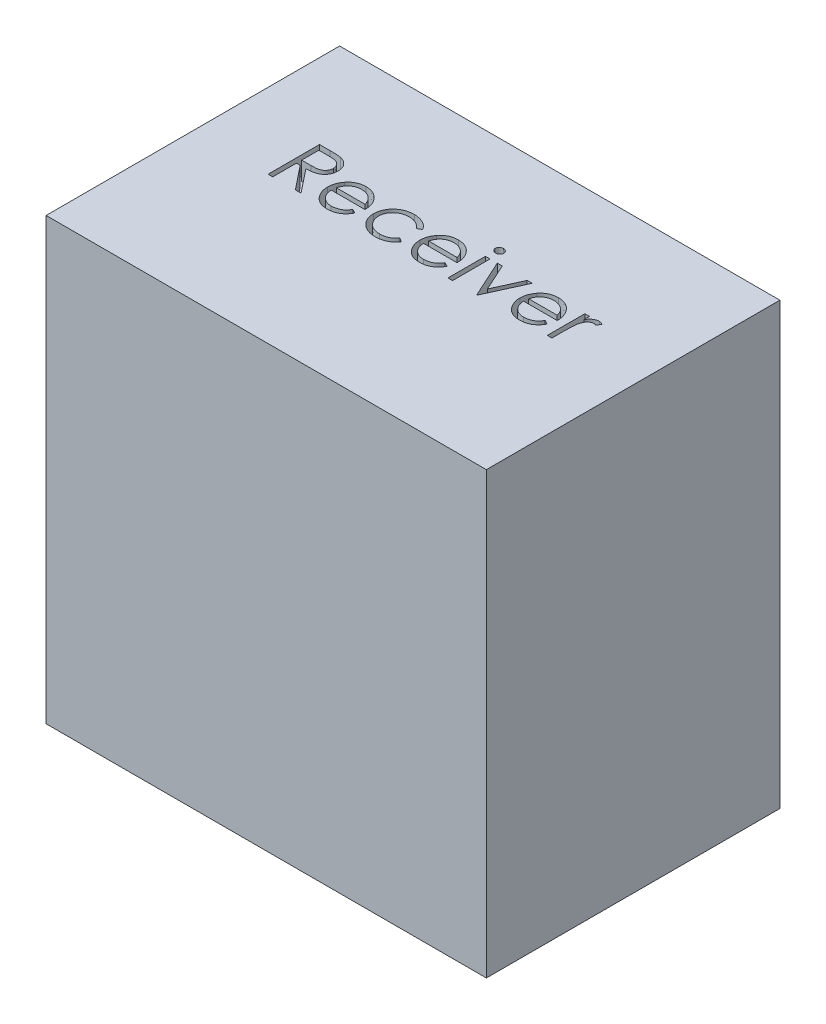
from build123d import *

# Parameters (mm, degrees)
SKETCH1_W           = 30
SKETCH1_H           = 20
BOSS_EXTRUDE1_DEPTH = 30
SKETCH2_W           = 0.314102564
SKETCH2_H           = 2.557692308
CUT_EXTRUDE1_DEPTH  = 1.27


with BuildPart() as part:
    # Sketch1 → Boss-Extrude1 (new body)
    with BuildSketch(Plane(origin=(0, 0, 0), x_dir=(1, 0, 0), z_dir=(0, 1, 0))):
        with Locations((15, 10)):
            Rectangle(SKETCH1_W, SKETCH1_H)
    extrude(amount=BOSS_EXTRUDE1_DEPTH)

    # Sketch2 → Cut-Extrude1 (cut)
    # profile 1 of 9: a face of its own
    with BuildSketch(Plane(origin=(0, 30, 0), x_dir=(1, 0, 0), z_dir=(0, 1, 0))):
        with BuildLine():
            Line((5.128205128, 13.5), (5.828625801, 13.5))
            add(Edge.make_bspline(
                [(5.828625801, 13.5), (5.87536693, 13.499844414), (5.965115074, 13.499545672), (6.093688345, 13.497879909), (6.210515442, 13.493105553), (6.315535281, 13.48899697), (6.408745936, 13.481505028), (6.490433227, 13.474344381), (6.560220924, 13.46497072), (6.602466775, 13.456265297), (6.621594551, 13.452323718)],
                knots=[0, 0, 0, 0, 1.410062039, 2.707475311, 3.878576406, 4.937260626, 5.877586885, 6.699081471, 7.410979367, 8, 8, 8, 8], degree=3))
            add(Edge.make_bspline(
                [(6.621594551, 13.452323718), (6.647201175, 13.445996953), (6.697868165, 13.433478389), (6.770818231, 13.407018788), (6.840332555, 13.376399163), (6.906122379, 13.340435443), (6.96785817, 13.298860663), (7.026176481, 13.252392541), (7.081341945, 13.201285335), (7.131123575, 13.144250494), (7.178062626, 13.084413984), (7.217651253, 13.019710227), (7.251777733, 12.9520487), (7.27894825, 12.880741282), (7.300826223, 12.80647951), (7.316252463, 12.728590713), (7.32550365, 12.647429738), (7.326445506, 12.59207183), (7.326923077, 12.564002404)],
                knots=[0, 0, 0, 0, 1.027469482, 2.033020251, 3.019912614, 3.986113645, 4.951240523, 5.91722682, 6.890402269, 7.87763091, 8.8651537, 9.85103654, 10.82876324, 11.815024772, 12.821070561, 13.842952187, 14.906261191, 16, 16, 16, 16], degree=3))
            add(Edge.make_bspline(
                [(7.326923077, 12.564002404), (7.325454079, 12.517367299), (7.322587683, 12.426370131), (7.295862579, 12.29430925), (7.25208606, 12.171119935), (7.191762771, 12.056957297), (7.114943295, 11.954046652), (7.022618504, 11.863656197), (6.914736892, 11.788016284), (6.814307576, 11.735563479), (6.725593377, 11.701970571), (6.652560064, 11.678334212), (6.572893086, 11.660072247), (6.487355752, 11.643712115), (6.395592096, 11.63136042), (6.297822057, 11.622313826), (6.193975905, 11.616659777), (6.122636836, 11.615817772), (6.0859375, 11.615384615)],
                knots=[0, 0, 0, 0, 1.260483769, 2.459530307, 3.627416485, 4.787058657, 5.939039949, 7.08810263, 8.267026773, 9.491475466, 10.141966685, 10.831826277, 11.566392101, 12.351337768, 13.187381173, 14.07005841, 15.007169909, 16, 16, 16, 16], degree=3))
            Line((6.0859375, 11.615384615), (7.371794872, 10))
            Line((7.371794872, 10), (6.983373397, 10))
            Line((6.983373397, 10), (5.697516026, 11.615384615))
            Line((5.697516026, 11.615384615), (5.442307692, 11.615384615))
            Line((5.442307692, 11.615384615), (5.442307692, 10))
            Line((5.442307692, 10), (5.128205128, 10))
            Line((5.128205128, 10), (5.128205128, 13.5))
        make_face()
        with BuildLine():
            Line((5.442307692, 13.141025641), (5.442307692, 11.974358974))
            Line((5.442307692, 11.974358974), (6.083133013, 11.969451122))
            add(Edge.make_bspline(
                [(6.083133013, 11.969451122), (6.113053052, 11.969437885), (6.171046609, 11.969412229), (6.254947274, 11.973406005), (6.333067385, 11.977949323), (6.405108138, 11.984898669), (6.471101713, 11.99385474), (6.531015126, 12.005057725), (6.584946178, 12.018109787), (6.647844716, 12.038311413), (6.718081248, 12.070317431), (6.794412708, 12.11688293), (6.859415045, 12.175452049), (6.914332908, 12.242425505), (6.958462339, 12.316061754), (6.989574393, 12.395478123), (7.009316836, 12.478669721), (7.011645381, 12.535847829), (7.012820513, 12.564703526)],
                knots=[0, 0, 0, 0, 1.146690395, 2.22261258, 3.21895312, 4.145990853, 4.996080663, 5.770904154, 6.481378293, 7.121626537, 8.300444488, 9.431385265, 10.535395872, 11.636531494, 12.74115979, 13.810798291, 14.895190096, 16, 16, 16, 16], degree=3))
            add(Edge.make_bspline(
                [(7.012820513, 12.564703526), (7.011618392, 12.592850099), (7.009236226, 12.648626338), (6.989787458, 12.730282248), (6.956898076, 12.807349198), (6.912575839, 12.879513683), (6.858576684, 12.945019419), (6.795258871, 13.001066572), (6.724353676, 13.047316037), (6.658082477, 13.076870418), (6.598848265, 13.094990271), (6.547418605, 13.107741435), (6.489307127, 13.117985904), (6.424231669, 13.126193964), (6.352470038, 13.133248909), (6.273659387, 13.138000687), (6.188322606, 13.140814551), (6.129175675, 13.14095364), (6.098557692, 13.141025641)],
                knots=[0, 0, 0, 0, 1.101028733, 2.181837193, 3.264309656, 4.369019818, 5.486613113, 6.575447106, 7.666700264, 8.788928104, 9.402425223, 10.0903467, 10.862060571, 11.710948788, 12.657782767, 13.684531032, 14.801375019, 16, 16, 16, 16], degree=3))
            Line((6.098557692, 13.141025641), (5.442307692, 13.141025641))
        make_face(mode=Mode.SUBTRACT)
    # profile 2 of 9: a face of its own
    with BuildSketch(Plane(origin=(0, 30, 0), x_dir=(1, 0, 0), z_dir=(0, 1, 0))):
        with BuildLine():
            Line((10.099158654, 10.807692308), (10.378205128, 10.661157853))
            add(Edge.make_bspline(
                [(10.378205128, 10.661157853), (10.355968533, 10.621714521), (10.312704924, 10.544973418), (10.238304177, 10.439541558), (10.160312104, 10.344693842), (10.075208136, 10.262964188), (9.985538457, 10.191712803), (9.890805802, 10.129374978), (9.790516985, 10.076256458), (9.68466726, 10.03150393), (9.572367709, 9.997094436), (9.453346192, 9.972790215), (9.327374697, 9.957766946), (9.241028517, 9.956021806), (9.196814904, 9.955128205)],
                knots=[0, 0, 0, 0, 1.120438281, 2.179929193, 3.190490725, 4.156257408, 5.095198341, 6.022838206, 6.959905092, 7.901321166, 8.864066838, 9.862729781, 10.905609505, 12, 12, 12, 12], degree=3))
            add(Edge.make_bspline(
                [(9.196814904, 9.955128205), (9.147672926, 9.95627538), (9.051811165, 9.958513187), (8.912271418, 9.977805652), (8.780891999, 10.00927801), (8.657680296, 10.053243552), (8.542938043, 10.110670876), (8.436437188, 10.180630358), (8.337617663, 10.262762612), (8.249593453, 10.357779056), (8.170349571, 10.459461013), (8.100423751, 10.565416898), (8.04196632, 10.675380122), (7.994413709, 10.788650646), (7.956008844, 10.90451454), (7.929242141, 11.024026007), (7.913812393, 11.146861592), (7.911447947, 11.229958927), (7.91025641, 11.271834936)],
                knots=[0, 0, 0, 0, 1.145258523, 2.234067595, 3.276747158, 4.290159414, 5.277019952, 6.260822364, 7.254936242, 8.264827045, 9.274100331, 10.257902744, 11.220704747, 12.172965371, 13.118907548, 14.062713208, 15.023725156, 16, 16, 16, 16], degree=3))
            add(Edge.make_bspline(
                [(7.91025641, 11.271834936), (7.911315552, 11.311129766), (7.91341463, 11.389006931), (7.926645417, 11.504272476), (7.95009371, 11.616300928), (7.982270034, 11.725185376), (8.02382128, 11.83074351), (8.0746535, 11.933039574), (8.134845877, 12.031964713), (8.181318551, 12.094367847), (8.204727564, 12.125801282)],
                knots=[0, 0, 0, 0, 1.024358464, 2.0301432, 3.019427413, 4.004406732, 4.986367066, 5.972626655, 6.978780325, 8, 8, 8, 8], degree=3))
            add(Edge.make_bspline(
                [(8.204727564, 12.125801282), (8.236435247, 12.163670152), (8.298846193, 12.238208303), (8.404402549, 12.336146628), (8.518702745, 12.418190404), (8.640314371, 12.48619754), (8.770650845, 12.537871187), (8.907960136, 12.576378769), (9.053805723, 12.59795678), (9.153510943, 12.601004614), (9.204527244, 12.602564103)],
                knots=[0, 0, 0, 0, 1.030682036, 2.02871468, 2.997146059, 3.962720338, 4.930598197, 5.918074684, 6.934738563, 8, 8, 8, 8], degree=3))
            add(Edge.make_bspline(
                [(9.204527244, 12.602564103), (9.256974849, 12.601210054), (9.359865095, 12.598553718), (9.509897216, 12.573927385), (9.651857932, 12.53487483), (9.785690437, 12.47972104), (9.911408297, 12.408561488), (10.028194347, 12.320419647), (10.13804586, 12.218001559), (10.201954438, 12.13923835), (10.23447516, 12.099158654)],
                knots=[0, 0, 0, 0, 1.056321875, 2.072262726, 3.055038591, 4.01806755, 4.982017516, 5.957941055, 6.960871419, 8, 8, 8, 8], degree=3))
            add(Edge.make_bspline(
                [(10.23447516, 12.099158654), (10.256602099, 12.068955072), (10.300708692, 12.008748954), (10.355955792, 11.910577797), (10.403913187, 11.807867202), (10.442246148, 11.698956905), (10.473285649, 11.585137325), (10.495742468, 11.46559478), (10.508912086, 11.340364869), (10.511500784, 11.255038314), (10.512820513, 11.211538462)],
                knots=[0, 0, 0, 0, 0.94817472, 1.890038105, 2.849395472, 3.817997239, 4.812318967, 5.836947057, 6.897266129, 8, 8, 8, 8], degree=3))
            Line((10.512820513, 11.211538462), (8.224358974, 11.211538462))
            add(Edge.make_bspline(
                [(8.224358974, 11.211538462), (8.225898581, 11.177837997), (8.228926155, 11.111567394), (8.243041298, 11.01459661), (8.265290072, 10.922223268), (8.296559134, 10.835140226), (8.33442598, 10.752210099), (8.380811696, 10.674048062), (8.43615125, 10.601010132), (8.49787695, 10.532442994), (8.566584045, 10.471382233), (8.638866792, 10.416730457), (8.715760357, 10.37092486), (8.796658441, 10.33374497), (8.881430226, 10.304638654), (8.970102421, 10.284770834), (9.062500537, 10.271463727), (9.125486271, 10.269984061), (9.157552083, 10.269230769)],
                knots=[0, 0, 0, 0, 1.094153842, 2.151609401, 3.174256925, 4.172055639, 5.149267565, 6.128595816, 7.11444997, 8.118368179, 9.117203808, 10.09244225, 11.054858984, 12.015122123, 12.976791628, 13.957293641, 14.960065497, 16, 16, 16, 16], degree=3))
            add(Edge.make_bspline(
                [(9.157552083, 10.269230769), (9.188903231, 10.269838826), (9.251109922, 10.271045327), (9.343750779, 10.282777238), (9.434890307, 10.301747513), (9.52415129, 10.327637504), (9.609722136, 10.359214356), (9.688967686, 10.397317213), (9.761847901, 10.43946696), (9.829964868, 10.487676635), (9.896035861, 10.546684822), (9.961578348, 10.620320543), (10.031855001, 10.707408071), (10.075844594, 10.772953737), (10.099158654, 10.807692308)],
                knots=[0, 0, 0, 0, 0.99110716, 1.966546729, 2.947904876, 3.932708344, 4.903319531, 5.828989031, 6.710028674, 7.56322171, 8.463672341, 9.504779593, 10.677557249, 12, 12, 12, 12], degree=3))
        make_face()
        with BuildLine():
            add(Edge.make_bspline(
                [(10.198717949, 11.525641026), (10.187221324, 11.567303899), (10.165094023, 11.64749152), (10.118857658, 11.75853241), (10.066786118, 11.857220311), (10.005164386, 11.942799944), (9.935345661, 12.018803457), (9.854700478, 12.085222043), (9.764264584, 12.144639494), (9.664505444, 12.194791993), (9.558863659, 12.237481852), (9.448257467, 12.266106968), (9.335399679, 12.28571651), (9.259065392, 12.287542618), (9.220653045, 12.288461538)],
                knots=[0, 0, 0, 0, 1.154881502, 2.222775134, 3.210006277, 4.132804581, 5.035138423, 5.962687519, 6.919655026, 7.923214229, 8.944639381, 9.960483929, 10.97369054, 12, 12, 12, 12], degree=3))
            add(Edge.make_bspline(
                [(9.220653045, 12.288461538), (9.189303606, 12.287849867), (9.127332357, 12.286640721), (9.036031289, 12.275170592), (8.94835159, 12.256210747), (8.863646303, 12.23024579), (8.783025434, 12.195637188), (8.704830666, 12.155053961), (8.63105027, 12.105512377), (8.584908974, 12.067753522), (8.561598558, 12.048677885)],
                knots=[0, 0, 0, 0, 1.04873581, 2.073130211, 3.073294108, 4.04793562, 5.032784715, 6.005352987, 6.992311501, 8, 8, 8, 8], degree=3))
            add(Edge.make_bspline(
                [(8.561598558, 12.048677885), (8.544905276, 12.033583569), (8.511122142, 12.003036353), (8.46598162, 11.950407146), (8.422761147, 11.893655584), (8.383427495, 11.83061046), (8.347349908, 11.761989681), (8.313589931, 11.688372045), (8.283203519, 11.609198915), (8.266107409, 11.554026476), (8.257311699, 11.525641026)],
                knots=[0, 0, 0, 0, 0.879870761, 1.780643979, 2.707998968, 3.669668524, 4.684282772, 5.740141944, 6.837334558, 8, 8, 8, 8], degree=3))
            Line((8.257311699, 11.525641026), (10.198717949, 11.525641026))
        make_face(mode=Mode.SUBTRACT)
    # profile 3 of 9: a face of its own
    with BuildSketch(Plane(origin=(0, 30, 0), x_dir=(1, 0, 0), z_dir=(0, 1, 0))):
        with BuildLine():
            Line((13.653846154, 12.003104968), (13.390925481, 11.83974359))
            add(Edge.make_bspline(
                [(13.390925481, 11.83974359), (13.362095615, 11.875571984), (13.30534892, 11.946094094), (13.206809684, 12.037104027), (13.10179827, 12.115271069), (12.988520222, 12.17897482), (12.867134422, 12.22819627), (12.738119571, 12.263026476), (12.601494066, 12.284730719), (12.507828867, 12.287197555), (12.459835737, 12.288461538)],
                knots=[0, 0, 0, 0, 1.026593902, 2.0206758, 2.988051866, 3.946915611, 4.916868779, 5.907761954, 6.927957743, 8, 8, 8, 8], degree=3))
            add(Edge.make_bspline(
                [(12.459835737, 12.288461538), (12.42147678, 12.287404696), (12.345929858, 12.285323274), (12.235023704, 12.272312781), (12.129381351, 12.248670773), (12.028340642, 12.217519816), (11.932620224, 12.175769526), (11.841969305, 12.12495977), (11.755583815, 12.06590973), (11.675967074, 11.997499184), (11.603138067, 11.923100516), (11.540039153, 11.843346821), (11.48510222, 11.76062693), (11.441996263, 11.672875188), (11.406721093, 11.582099134), (11.383514373, 11.486585279), (11.368049677, 11.387557271), (11.366280348, 11.320038931), (11.365384615, 11.285857372)],
                knots=[0, 0, 0, 0, 1.112346261, 2.190735716, 3.231507886, 4.247384806, 5.251966152, 6.253067467, 7.256802811, 8.280671706, 9.291813951, 10.270744147, 11.225547591, 12.165006084, 13.100104208, 14.043489273, 15.009504848, 16, 16, 16, 16], degree=3))
            add(Edge.make_bspline(
                [(11.365384615, 11.285857372), (11.367163868, 11.241088161), (11.370698398, 11.152152965), (11.398399858, 11.020874863), (11.443744265, 10.893951173), (11.505802116, 10.772283036), (11.58427925, 10.65968888), (11.676451814, 10.558705426), (11.782370897, 10.471289398), (11.901103228, 10.398816873), (12.029860971, 10.340555505), (12.167251076, 10.299048172), (12.312150856, 10.2739958), (12.411357603, 10.270839857), (12.461939103, 10.269230769)],
                knots=[0, 0, 0, 0, 0.966302908, 1.919585723, 2.883856336, 3.870342332, 4.860282998, 5.839159637, 6.814385684, 7.815993281, 8.834850808, 9.858348828, 10.908058873, 12, 12, 12, 12], degree=3))
            add(Edge.make_bspline(
                [(12.461939103, 10.269230769), (12.508294287, 10.270530266), (12.599394525, 10.273084123), (12.73256181, 10.294613087), (12.859341721, 10.32985672), (12.979729752, 10.37900437), (13.093505918, 10.442531886), (13.199935093, 10.520891057), (13.301135031, 10.611827657), (13.360632008, 10.682145629), (13.390925481, 10.717948718)],
                knots=[0, 0, 0, 0, 1.039848629, 2.043578496, 3.018386758, 3.987534228, 4.954977003, 5.934852016, 6.948509513, 8, 8, 8, 8], degree=3))
            Line((13.390925481, 10.717948718), (13.653846154, 10.545472756))
            add(Edge.make_bspline(
                [(13.653846154, 10.545472756), (13.638258452, 10.522582029), (13.607134785, 10.476876553), (13.555107159, 10.412432436), (13.498987328, 10.352110754), (13.438994231, 10.295992364), (13.375911221, 10.242734345), (13.307583311, 10.19488277), (13.2362137, 10.149747947), (13.160964542, 10.109135075), (13.082613844, 10.072628754), (13.001271854, 10.041237583), (12.917292042, 10.014267477), (12.830575666, 9.99283013), (12.740951767, 9.975719292), (12.648652133, 9.96436559), (12.553708551, 9.955890309), (12.4895364, 9.955384442), (12.45703125, 9.955128205)],
                knots=[0, 0, 0, 0, 0.954134338, 1.905101784, 2.851144739, 3.791306361, 4.734911809, 5.6936923, 6.663572882, 7.643865596, 8.638447847, 9.640600242, 10.646758161, 11.676244097, 12.717260333, 13.78922464, 14.880174919, 16, 16, 16, 16], degree=3))
            add(Edge.make_bspline(
                [(12.45703125, 9.955128205), (12.407420366, 9.956019485), (12.310182674, 9.9577664), (12.167860167, 9.976974875), (12.031846499, 10.005932491), (11.902188141, 10.047496225), (11.778864907, 10.101001001), (11.661991789, 10.166357915), (11.551955771, 10.244109705), (11.449844988, 10.332872475), (11.356063542, 10.429113115), (11.275537351, 10.532963033), (11.205692081, 10.640604081), (11.149604538, 10.754413607), (11.104957611, 10.87287898), (11.074452779, 10.99694922), (11.054723041, 11.125601474), (11.052439662, 11.213334356), (11.051282051, 11.2578125)],
                knots=[0, 0, 0, 0, 1.1129367, 2.181364009, 3.217532258, 4.231199276, 5.232079859, 6.230262199, 7.231623845, 8.250719726, 9.263571943, 10.242672461, 11.195837495, 12.138959767, 13.085126421, 14.0317438, 15.002148558, 16, 16, 16, 16], degree=3))
            add(Edge.make_bspline(
                [(11.051282051, 11.2578125), (11.051723067, 11.287990935), (11.052600321, 11.348020822), (11.062662249, 11.437115889), (11.075660722, 11.525024434), (11.097686459, 11.610632153), (11.123127091, 11.695237443), (11.155602623, 11.777820545), (11.193698017, 11.858765217), (11.236949965, 11.937862947), (11.28563871, 12.013812487), (11.339519943, 12.085566151), (11.396564279, 12.153985917), (11.459440391, 12.216709677), (11.525480045, 12.276245869), (11.596551621, 12.331003993), (11.672247473, 12.381144984), (11.751430795, 12.427595999), (11.834055506, 12.468955434), (11.919622177, 12.504588672), (12.007615206, 12.535041248), (12.09817535, 12.559150167), (12.190701523, 12.579367591), (12.285922861, 12.592085437), (12.383475084, 12.60107171), (12.449531106, 12.602062502), (12.482972756, 12.602564103)],
                knots=[0, 0, 0, 0, 0.990994727, 1.971252077, 2.943264845, 3.907940874, 4.872158414, 5.844625996, 6.82015047, 7.809835459, 8.804511986, 9.781214284, 10.756496977, 11.728388426, 12.696359165, 13.676225489, 14.672885716, 15.677705647, 16.690706858, 17.706033469, 18.721040654, 19.747369689, 20.783475414, 21.830280724, 22.901553713, 24, 24, 24, 24], degree=3))
            add(Edge.make_bspline(
                [(12.482972756, 12.602564103), (12.524852864, 12.601642212), (12.608403744, 12.599803037), (12.732344451, 12.584324385), (12.854459645, 12.560987969), (12.972606748, 12.526415139), (13.085353263, 12.484551483), (13.190888713, 12.437538769), (13.286728817, 12.382944165), (13.374656406, 12.323224051), (13.454835923, 12.255863145), (13.528090416, 12.180056188), (13.595922065, 12.096197709), (13.634378776, 12.034391978), (13.653846154, 12.003104968)],
                knots=[0, 0, 0, 0, 1.095225653, 2.184976855, 3.262915854, 4.344593502, 5.400796181, 6.407717688, 7.363229445, 8.282371371, 9.184954523, 10.097238608, 11.036792983, 12, 12, 12, 12], degree=3))
        make_face()
    # profile 4 of 9: a face of its own
    with BuildSketch(Plane(origin=(0, 30, 0), x_dir=(1, 0, 0), z_dir=(0, 1, 0))):
        with BuildLine():
            Line((16.381209936, 10.807692308), (16.66025641, 10.661157853))
            add(Edge.make_bspline(
                [(16.66025641, 10.661157853), (16.638019815, 10.621714521), (16.594756207, 10.544973418), (16.520355459, 10.439541558), (16.442363386, 10.344693842), (16.357259418, 10.262964188), (16.267589739, 10.191712803), (16.172857084, 10.129374978), (16.072568267, 10.076256458), (15.966718542, 10.03150393), (15.854418991, 9.997094436), (15.735397474, 9.972790215), (15.609425979, 9.957766946), (15.523079799, 9.956021806), (15.478866186, 9.955128205)],
                knots=[0, 0, 0, 0, 1.120438281, 2.179929193, 3.190490725, 4.156257408, 5.095198341, 6.022838206, 6.959905092, 7.901321166, 8.864066838, 9.862729781, 10.905609505, 12, 12, 12, 12], degree=3))
            add(Edge.make_bspline(
                [(15.478866186, 9.955128205), (15.429724208, 9.95627538), (15.333862447, 9.958513187), (15.1943227, 9.977805652), (15.062943281, 10.00927801), (14.939731578, 10.053243552), (14.824989325, 10.110670876), (14.71848847, 10.180630358), (14.619668945, 10.262762612), (14.531644735, 10.357779056), (14.452400853, 10.459461013), (14.382475033, 10.565416898), (14.324017602, 10.675380122), (14.276464991, 10.788650646), (14.238060126, 10.90451454), (14.211293423, 11.024026007), (14.195863675, 11.146861592), (14.193499229, 11.229958927), (14.192307692, 11.271834936)],
                knots=[0, 0, 0, 0, 1.145258523, 2.234067595, 3.276747158, 4.290159414, 5.277019952, 6.260822364, 7.254936242, 8.264827045, 9.274100331, 10.257902744, 11.220704747, 12.172965371, 13.118907548, 14.062713208, 15.023725156, 16, 16, 16, 16], degree=3))
            add(Edge.make_bspline(
                [(14.192307692, 11.271834936), (14.193366834, 11.311129766), (14.195465912, 11.389006931), (14.208696699, 11.504272476), (14.232144992, 11.616300928), (14.264321316, 11.725185376), (14.305872562, 11.83074351), (14.356704782, 11.933039574), (14.416897159, 12.031964713), (14.463369833, 12.094367847), (14.486778846, 12.125801282)],
                knots=[0, 0, 0, 0, 1.024358464, 2.0301432, 3.019427413, 4.004406732, 4.986367066, 5.972626655, 6.978780325, 8, 8, 8, 8], degree=3))
            add(Edge.make_bspline(
                [(14.486778846, 12.125801282), (14.518486529, 12.163670152), (14.580897476, 12.238208303), (14.686453831, 12.336146628), (14.800754027, 12.418190404), (14.922365653, 12.48619754), (15.052702127, 12.537871187), (15.190011418, 12.576378769), (15.335857005, 12.59795678), (15.435562225, 12.601004614), (15.486578526, 12.602564103)],
                knots=[0, 0, 0, 0, 1.030682036, 2.02871468, 2.997146059, 3.962720338, 4.930598197, 5.918074684, 6.934738563, 8, 8, 8, 8], degree=3))
            add(Edge.make_bspline(
                [(15.486578526, 12.602564103), (15.539026131, 12.601210054), (15.641916377, 12.598553718), (15.791948498, 12.573927385), (15.933909214, 12.53487483), (16.067741719, 12.47972104), (16.19345958, 12.408561488), (16.310245629, 12.320419647), (16.420097142, 12.218001559), (16.48400572, 12.13923835), (16.516526442, 12.099158654)],
                knots=[0, 0, 0, 0, 1.056321875, 2.072262726, 3.055038591, 4.01806755, 4.982017516, 5.957941055, 6.960871419, 8, 8, 8, 8], degree=3))
            add(Edge.make_bspline(
                [(16.516526442, 12.099158654), (16.538653381, 12.068955072), (16.582759974, 12.008748954), (16.638007074, 11.910577797), (16.685964469, 11.807867202), (16.72429743, 11.698956905), (16.755336931, 11.585137325), (16.77779375, 11.46559478), (16.790963368, 11.340364869), (16.793552066, 11.255038314), (16.794871795, 11.211538462)],
                knots=[0, 0, 0, 0, 0.94817472, 1.890038105, 2.849395472, 3.817997239, 4.812318967, 5.836947057, 6.897266129, 8, 8, 8, 8], degree=3))
            Line((16.794871795, 11.211538462), (14.506410256, 11.211538462))
            add(Edge.make_bspline(
                [(14.506410256, 11.211538462), (14.507949863, 11.177837997), (14.510977437, 11.111567394), (14.52509258, 11.01459661), (14.547341354, 10.922223268), (14.578610416, 10.835140226), (14.616477262, 10.752210099), (14.662862978, 10.674048062), (14.718202532, 10.601010132), (14.779928232, 10.532442994), (14.848635327, 10.471382233), (14.920918074, 10.416730457), (14.997811639, 10.37092486), (15.078709723, 10.33374497), (15.163481508, 10.304638654), (15.252153703, 10.284770834), (15.344551819, 10.271463727), (15.407537553, 10.269984061), (15.439603365, 10.269230769)],
                knots=[0, 0, 0, 0, 1.094153842, 2.151609401, 3.174256925, 4.172055639, 5.149267565, 6.128595816, 7.11444997, 8.118368179, 9.117203808, 10.09244225, 11.054858984, 12.015122123, 12.976791628, 13.957293641, 14.960065497, 16, 16, 16, 16], degree=3))
            add(Edge.make_bspline(
                [(15.439603365, 10.269230769), (15.470954513, 10.269838826), (15.533161204, 10.271045327), (15.625802061, 10.282777238), (15.716941589, 10.301747513), (15.806202572, 10.327637504), (15.891773418, 10.359214356), (15.971018968, 10.397317213), (16.043899184, 10.43946696), (16.11201615, 10.487676635), (16.178087143, 10.546684822), (16.24362963, 10.620320543), (16.313906283, 10.707408071), (16.357895876, 10.772953737), (16.381209936, 10.807692308)],
                knots=[0, 0, 0, 0, 0.99110716, 1.966546729, 2.947904876, 3.932708344, 4.903319531, 5.828989031, 6.710028674, 7.56322171, 8.463672341, 9.504779593, 10.677557249, 12, 12, 12, 12], degree=3))
        make_face()
        with BuildLine():
            add(Edge.make_bspline(
                [(16.480769231, 11.525641026), (16.469272606, 11.567303899), (16.447145305, 11.64749152), (16.40090894, 11.75853241), (16.3488374, 11.857220311), (16.287215668, 11.942799944), (16.217396943, 12.018803457), (16.13675176, 12.085222043), (16.046315866, 12.144639494), (15.946556726, 12.194791993), (15.840914941, 12.237481852), (15.730308749, 12.266106968), (15.617450961, 12.28571651), (15.541116675, 12.287542618), (15.502704327, 12.288461538)],
                knots=[0, 0, 0, 0, 1.154881502, 2.222775134, 3.210006277, 4.132804581, 5.035138423, 5.962687519, 6.919655026, 7.923214229, 8.944639381, 9.960483929, 10.97369054, 12, 12, 12, 12], degree=3))
            add(Edge.make_bspline(
                [(15.502704327, 12.288461538), (15.471354888, 12.287849867), (15.409383639, 12.286640721), (15.318082571, 12.275170592), (15.230402872, 12.256210747), (15.145697585, 12.23024579), (15.065076716, 12.195637188), (14.986881948, 12.155053961), (14.913101552, 12.105512377), (14.866960256, 12.067753522), (14.84364984, 12.048677885)],
                knots=[0, 0, 0, 0, 1.04873581, 2.073130211, 3.073294108, 4.04793562, 5.032784715, 6.005352987, 6.992311501, 8, 8, 8, 8], degree=3))
            add(Edge.make_bspline(
                [(14.84364984, 12.048677885), (14.826956558, 12.033583569), (14.793173424, 12.003036353), (14.748032902, 11.950407146), (14.704812429, 11.893655584), (14.665478777, 11.83061046), (14.62940119, 11.761989681), (14.595641213, 11.688372045), (14.565254801, 11.609198915), (14.548158691, 11.554026476), (14.539362981, 11.525641026)],
                knots=[0, 0, 0, 0, 0.879870761, 1.780643979, 2.707998968, 3.669668524, 4.684282772, 5.740141944, 6.837334558, 8, 8, 8, 8], degree=3))
            Line((14.539362981, 11.525641026), (16.480769231, 11.525641026))
        make_face(mode=Mode.SUBTRACT)
    # profile 5 of 9: a face of its own
    with BuildSketch(Plane(origin=(0, 30, 0), x_dir=(1, 0, 0), z_dir=(0, 1, 0))):
        with BuildLine():
            add(Edge.make_bspline(
                [(17.533854167, 13.634615385), (17.553345482, 13.633711232), (17.591513222, 13.631940728), (17.64670649, 13.616779251), (17.696963502, 13.591079566), (17.741541235, 13.556599885), (17.779793122, 13.516050441), (17.806573832, 13.468789473), (17.823786228, 13.417730834), (17.825864783, 13.382115745), (17.826923077, 13.363982372)],
                knots=[0, 0, 0, 0, 1.055194115, 2.066272739, 3.074728998, 4.095836921, 5.109056067, 6.073838105, 7.019297344, 8, 8, 8, 8], degree=3))
            add(Edge.make_bspline(
                [(17.826923077, 13.363982372), (17.825840917, 13.346319719), (17.823701615, 13.311402744), (17.806587127, 13.261229272), (17.779564889, 13.214624988), (17.741565763, 13.174154278), (17.696957002, 13.139693658), (17.646708217, 13.113988919), (17.591512768, 13.098828782), (17.553345329, 13.097058093), (17.533854167, 13.096153846)],
                knots=[0, 0, 0, 0, 0.96129708, 1.900370562, 2.859976407, 3.87933698, 4.906634145, 5.921202961, 6.938410037, 8, 8, 8, 8], degree=3))
            add(Edge.make_bspline(
                [(17.533854167, 13.096153846), (17.514585891, 13.097023566), (17.477082711, 13.098716363), (17.422715869, 13.114286381), (17.37288738, 13.139702454), (17.328222707, 13.173928639), (17.290992514, 13.214873536), (17.263894188, 13.26120083), (17.246819227, 13.311409985), (17.244674598, 13.346322151), (17.243589744, 13.363982372)],
                knots=[0, 0, 0, 0, 1.054934014, 2.053291228, 3.073705704, 4.106921865, 5.123545215, 6.088680038, 7.033164197, 8, 8, 8, 8], degree=3))
            add(Edge.make_bspline(
                [(17.243589744, 13.363982372), (17.24465083, 13.382113221), (17.246734871, 13.417723354), (17.263906987, 13.468818387), (17.290766795, 13.515799889), (17.328247359, 13.556825388), (17.372880819, 13.591070823), (17.422717564, 13.616481804), (17.477082264, 13.632053144), (17.51458574, 13.633745758), (17.533854167, 13.634615385)],
                knots=[0, 0, 0, 0, 0.98631895, 1.937192651, 2.907499808, 3.917963147, 4.944918757, 5.95915025, 6.951458133, 8, 8, 8, 8], degree=3))
        make_face()
    # profile 6 of 9: a face of its own
    with BuildSketch(Plane(origin=(0, 30, 0), x_dir=(1, 0, 0), z_dir=(0, 1, 0))):
        with Locations((17.53525641, 11.278846154)):
            Rectangle(SKETCH2_W, SKETCH2_H)
    # profile 7 of 9: a face of its own
    with BuildSketch(Plane(origin=(0, 30, 0), x_dir=(1, 0, 0), z_dir=(0, 1, 0))):
        Polygon((18.185897436, 12.557692308), (18.525941506, 12.557692308), (19.375, 10.695512821), (20.224058494, 12.557692308), (20.564102564, 12.557692308), (19.397435897, 10), (19.352564103, 10), align=None)
    # profile 8 of 9: a face of its own
    with BuildSketch(Plane(origin=(0, 30, 0), x_dir=(1, 0, 0), z_dir=(0, 1, 0))):
        with BuildLine():
            Line((23.201722756, 10.807692308), (23.480769231, 10.661157853))
            add(Edge.make_bspline(
                [(23.480769231, 10.661157853), (23.458532636, 10.621714521), (23.415269027, 10.544973418), (23.340868279, 10.439541558), (23.262876207, 10.344693842), (23.177772239, 10.262964188), (23.08810256, 10.191712803), (22.993369905, 10.129374978), (22.893081087, 10.076256458), (22.787231362, 10.03150393), (22.674931811, 9.997094436), (22.555910295, 9.972790215), (22.429938799, 9.957766946), (22.34359262, 9.956021806), (22.299379006, 9.955128205)],
                knots=[0, 0, 0, 0, 1.120438281, 2.179929193, 3.190490725, 4.156257408, 5.095198341, 6.022838206, 6.959905092, 7.901321166, 8.864066838, 9.862729781, 10.905609505, 12, 12, 12, 12], degree=3))
            add(Edge.make_bspline(
                [(22.299379006, 9.955128205), (22.250237029, 9.95627538), (22.154375267, 9.958513187), (22.01483552, 9.977805652), (21.883456102, 10.00927801), (21.760244398, 10.053243552), (21.645502146, 10.110670876), (21.539001291, 10.180630358), (21.440181765, 10.262762612), (21.352157556, 10.357779056), (21.272913673, 10.459461013), (21.202987853, 10.565416898), (21.144530422, 10.675380122), (21.096977812, 10.788650646), (21.058572947, 10.90451454), (21.031806243, 11.024026007), (21.016376495, 11.146861592), (21.01401205, 11.229958927), (21.012820513, 11.271834936)],
                knots=[0, 0, 0, 0, 1.145258523, 2.234067595, 3.276747158, 4.290159414, 5.277019952, 6.260822364, 7.254936242, 8.264827045, 9.274100331, 10.257902744, 11.220704747, 12.172965371, 13.118907548, 14.062713208, 15.023725156, 16, 16, 16, 16], degree=3))
            add(Edge.make_bspline(
                [(21.012820513, 11.271834936), (21.013879654, 11.311129766), (21.015978732, 11.389006931), (21.02920952, 11.504272476), (21.052657813, 11.616300928), (21.084834137, 11.725185376), (21.126385383, 11.83074351), (21.177217602, 11.933039574), (21.23740998, 12.031964713), (21.283882654, 12.094367847), (21.307291667, 12.125801282)],
                knots=[0, 0, 0, 0, 1.024358464, 2.0301432, 3.019427413, 4.004406732, 4.986367066, 5.972626655, 6.978780325, 8, 8, 8, 8], degree=3))
            add(Edge.make_bspline(
                [(21.307291667, 12.125801282), (21.338999349, 12.163670152), (21.401410296, 12.238208303), (21.506966651, 12.336146628), (21.621266848, 12.418190404), (21.742878474, 12.48619754), (21.873214948, 12.537871187), (22.010524239, 12.576378769), (22.156369825, 12.59795678), (22.256075046, 12.601004614), (22.307091346, 12.602564103)],
                knots=[0, 0, 0, 0, 1.030682036, 2.02871468, 2.997146059, 3.962720338, 4.930598197, 5.918074684, 6.934738563, 8, 8, 8, 8], degree=3))
            add(Edge.make_bspline(
                [(22.307091346, 12.602564103), (22.359538951, 12.601210054), (22.462429197, 12.598553718), (22.612461318, 12.573927385), (22.754422035, 12.53487483), (22.888254539, 12.47972104), (23.0139724, 12.408561488), (23.13075845, 12.320419647), (23.240609962, 12.218001559), (23.304518541, 12.13923835), (23.337039263, 12.099158654)],
                knots=[0, 0, 0, 0, 1.056321875, 2.072262726, 3.055038591, 4.01806755, 4.982017516, 5.957941055, 6.960871419, 8, 8, 8, 8], degree=3))
            add(Edge.make_bspline(
                [(23.337039263, 12.099158654), (23.359166201, 12.068955072), (23.403272794, 12.008748954), (23.458519894, 11.910577797), (23.506477289, 11.807867202), (23.54481025, 11.698956905), (23.575849751, 11.585137325), (23.59830657, 11.46559478), (23.611476189, 11.340364869), (23.614064886, 11.255038314), (23.615384615, 11.211538462)],
                knots=[0, 0, 0, 0, 0.94817472, 1.890038105, 2.849395472, 3.817997239, 4.812318967, 5.836947057, 6.897266129, 8, 8, 8, 8], degree=3))
            Line((23.615384615, 11.211538462), (21.326923077, 11.211538462))
            add(Edge.make_bspline(
                [(21.326923077, 11.211538462), (21.328462683, 11.177837997), (21.331490257, 11.111567394), (21.3456054, 11.01459661), (21.367854174, 10.922223268), (21.399123237, 10.835140226), (21.436990082, 10.752210099), (21.483375799, 10.674048062), (21.538715353, 10.601010132), (21.600441052, 10.532442994), (21.669148148, 10.471382233), (21.741430895, 10.416730457), (21.81832446, 10.37092486), (21.899222543, 10.33374497), (21.983994328, 10.304638654), (22.072666524, 10.284770834), (22.16506464, 10.271463727), (22.228050374, 10.269984061), (22.260116186, 10.269230769)],
                knots=[0, 0, 0, 0, 1.094153842, 2.151609401, 3.174256925, 4.172055639, 5.149267565, 6.128595816, 7.11444997, 8.118368179, 9.117203808, 10.09244225, 11.054858984, 12.015122123, 12.976791628, 13.957293641, 14.960065497, 16, 16, 16, 16], degree=3))
            add(Edge.make_bspline(
                [(22.260116186, 10.269230769), (22.291467334, 10.269838826), (22.353674024, 10.271045327), (22.446314882, 10.282777238), (22.537454409, 10.301747513), (22.626715392, 10.327637504), (22.712286238, 10.359214356), (22.791531788, 10.397317213), (22.864412004, 10.43946696), (22.932528971, 10.487676635), (22.998599964, 10.546684822), (23.06414245, 10.620320543), (23.134419104, 10.707408071), (23.178408697, 10.772953737), (23.201722756, 10.807692308)],
                knots=[0, 0, 0, 0, 0.99110716, 1.966546729, 2.947904876, 3.932708344, 4.903319531, 5.828989031, 6.710028674, 7.56322171, 8.463672341, 9.504779593, 10.677557249, 12, 12, 12, 12], degree=3))
        make_face()
        with BuildLine():
            add(Edge.make_bspline(
                [(23.301282051, 11.525641026), (23.289785427, 11.567303899), (23.267658125, 11.64749152), (23.221421761, 11.75853241), (23.16935022, 11.857220311), (23.107728489, 11.942799944), (23.037909763, 12.018803457), (22.95726458, 12.085222043), (22.866828687, 12.144639494), (22.767069546, 12.194791993), (22.661427761, 12.237481852), (22.550821569, 12.266106968), (22.437963781, 12.28571651), (22.361629495, 12.287542618), (22.323217147, 12.288461538)],
                knots=[0, 0, 0, 0, 1.154881502, 2.222775134, 3.210006277, 4.132804581, 5.035138423, 5.962687519, 6.919655026, 7.923214229, 8.944639381, 9.960483929, 10.97369054, 12, 12, 12, 12], degree=3))
            add(Edge.make_bspline(
                [(22.323217147, 12.288461538), (22.291867709, 12.287849867), (22.22989646, 12.286640721), (22.138595392, 12.275170592), (22.050915693, 12.256210747), (21.966210405, 12.23024579), (21.885589537, 12.195637188), (21.807394769, 12.155053961), (21.733614372, 12.105512377), (21.687473077, 12.067753522), (21.66416266, 12.048677885)],
                knots=[0, 0, 0, 0, 1.04873581, 2.073130211, 3.073294108, 4.04793562, 5.032784715, 6.005352987, 6.992311501, 8, 8, 8, 8], degree=3))
            add(Edge.make_bspline(
                [(21.66416266, 12.048677885), (21.647469378, 12.033583569), (21.613686244, 12.003036353), (21.568545723, 11.950407146), (21.52532525, 11.893655584), (21.485991597, 11.83061046), (21.449914011, 11.761989681), (21.416154033, 11.688372045), (21.385767621, 11.609198915), (21.368671511, 11.554026476), (21.359875801, 11.525641026)],
                knots=[0, 0, 0, 0, 0.879870761, 1.780643979, 2.707998968, 3.669668524, 4.684282772, 5.740141944, 6.837334558, 8, 8, 8, 8], degree=3))
            Line((21.359875801, 11.525641026), (23.301282051, 11.525641026))
        make_face(mode=Mode.SUBTRACT)
    # profile 9 of 9: a face of its own
    with BuildSketch(Plane(origin=(0, 30, 0), x_dir=(1, 0, 0), z_dir=(0, 1, 0))):
        with BuildLine():
            Line((24.153846154, 12.557692308), (24.467948718, 12.557692308))
            Line((24.467948718, 12.557692308), (24.467948718, 12.181189904))
            add(Edge.make_bspline(
                [(24.467948718, 12.181189904), (24.491137477, 12.216245732), (24.535485798, 12.283289731), (24.609198727, 12.371959032), (24.684702058, 12.445374079), (24.762357246, 12.503877598), (24.842735345, 12.547690717), (24.924072297, 12.579783752), (25.007647767, 12.598761067), (25.063809691, 12.601294726), (25.091947115, 12.602564103)],
                knots=[0, 0, 0, 0, 1.2804753, 2.448899062, 3.506932113, 4.484331642, 5.4025378, 6.288909075, 7.142734305, 8, 8, 8, 8], degree=3))
            add(Edge.make_bspline(
                [(25.091947115, 12.602564103), (25.113773442, 12.601373576), (25.158682527, 12.59892399), (25.226665117, 12.581713165), (25.296708569, 12.554235143), (25.341850956, 12.52839492), (25.365384615, 12.514923878)],
                knots=[0, 0, 0, 0, 0.901110191, 1.854092781, 2.881294221, 4, 4, 4, 4], degree=3))
            Line((25.365384615, 12.514923878), (25.192908654, 12.242888622))
            add(Edge.make_bspline(
                [(25.192908654, 12.242888622), (25.177799633, 12.249628888), (25.149119818, 12.262423203), (25.107165252, 12.277565213), (25.068483915, 12.286481129), (25.043840357, 12.287831847), (25.032351763, 12.288461538)],
                knots=[0, 0, 0, 0, 1.180555205, 2.24091978, 3.179933427, 4, 4, 4, 4], degree=3))
            add(Edge.make_bspline(
                [(25.032351763, 12.288461538), (25.007146029, 12.286781501), (24.955733639, 12.283354712), (24.88024914, 12.256415904), (24.807001934, 12.212890664), (24.748830272, 12.164619552), (24.703788019, 12.118071755), (24.671647794, 12.077423352), (24.642165047, 12.031844721), (24.613994826, 11.982115037), (24.588328532, 11.927385191), (24.564373863, 11.868201977), (24.542715, 11.804496849), (24.530364756, 11.760114328), (24.524038462, 11.737379808)],
                knots=[0, 0, 0, 0, 1.125678352, 2.296057538, 3.5422874, 4.923748041, 5.663163013, 6.437101912, 7.23742474, 8.08941207, 8.991984279, 9.93940061, 10.944477711, 12, 12, 12, 12], degree=3))
            add(Edge.make_bspline(
                [(24.524038462, 11.737379808), (24.519306068, 11.717102634), (24.508824176, 11.672190235), (24.498632639, 11.596841711), (24.488563121, 11.507818052), (24.481466502, 11.404871459), (24.47488846, 11.288259015), (24.471178378, 11.15780307), (24.468075237, 11.013369718), (24.467992171, 10.912395365), (24.467948718, 10.859575321)],
                knots=[0, 0, 0, 0, 0.566838948, 1.255505196, 2.06880316, 3.007127437, 4.065329342, 5.249902469, 6.561414163, 8, 8, 8, 8], degree=3))
            Line((24.467948718, 10.859575321), (24.467948718, 10))
            Line((24.467948718, 10), (24.153846154, 10))
            Line((24.153846154, 10), (24.153846154, 12.557692308))
        make_face()
    extrude(amount=-CUT_EXTRUDE1_DEPTH, mode=Mode.SUBTRACT)


solid = part.part
